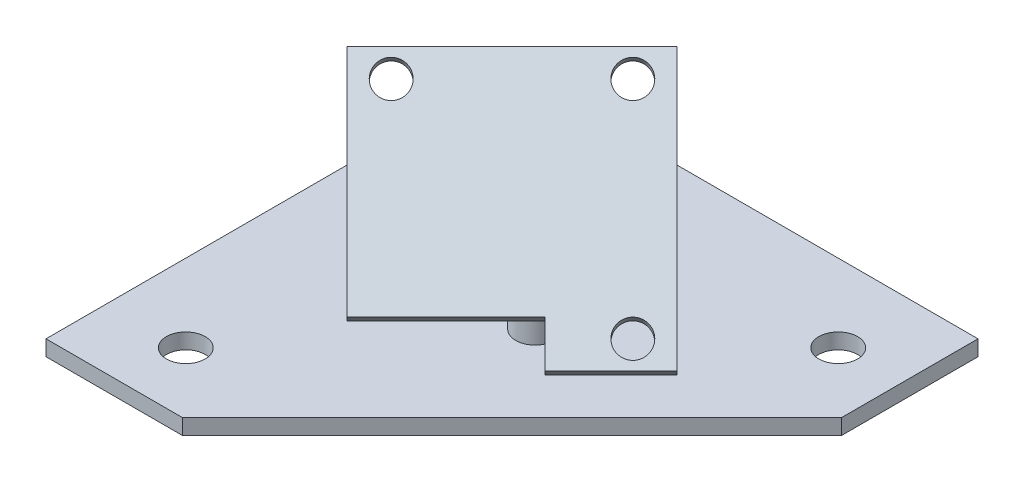
from build123d import *

# Parameters (mm, degrees)
SKETCH_1_R      = 2.5
EXTRUDE_1_DEPTH = 2
SKETCH_2_R      = 2
EXTRUDE_3_DEPTH = 2
EXTRUDE_4_REACH = 90.577
SKETCH_4_R      = 2.5


with BuildPart() as part:
    # 草图1 → 凸台-拉伸1 (new body)
    with BuildSketch(Plane(origin=(0, 0, 0), x_dir=(1, 0, 0), z_dir=(0, 1, 0))):
        Polygon((17.573593129, -60), (60, -17.573593129), (60, 0), (20, 0), (20, -20), (0, -20), (0, -60), align=None)
        with Locations(Location((10, -52, 0), (0, 0, 270))):
            Circle(SKETCH_1_R, mode=Mode.SUBTRACT)
        with Locations(Location((52, -10, 0), (0, 0, 270))):
            Circle(SKETCH_1_R, mode=Mode.SUBTRACT)
    extrude(amount=EXTRUDE_1_DEPTH)



with BuildPart() as body_2:
    # 草图2 → 凸台-拉伸3 (new body)
    with BuildSketch(Plane(origin=(20.100505063, 28.426406871, 20.100505063), x_dir=(-0.7071067811865476, 0, 0.7071067811865476), z_dir=(0.5000000000000009, 0.7071067811865465, 0.5000000000000009))):
        Polygon((-3, 33.431239936), (-15, 33.431239936), (-15, 3.431239936), (15, 3.431239936), (15, 28.431239936), (11, 28.431239936), (-3, 28.431239936), align=None)
        with Locations(Location((-11, 6.431239936, 0), (0, 0, 54.735610317))):
            Circle(SKETCH_2_R, mode=Mode.SUBTRACT)
        with Locations(Location((11, 6.431239936, 0), (0, 0, 54.735610317))):
            Circle(SKETCH_2_R, mode=Mode.SUBTRACT)
        with Locations(Location((-11, 30.431239936, 0), (0, 0, 54.735610317))):
            Circle(SKETCH_2_R, mode=Mode.SUBTRACT)
    extrude(amount=EXTRUDE_3_DEPTH)


with BuildPart() as part_1:
    add(part.part)

    add(body_2.part)  # 凸台-拉伸4 merges body 2
    # 凸台-拉伸4: up to this plane
    extrude_4_end = Plane(origin=(20.100505063, 28.426406871, 20.100505063), z_dir=(0.5000000000000009, 0.7071067811865464, 0.5000000000000009))
    # 草图4 → 凸台-拉伸4 (add, up to the surface)
    with BuildSketch(Plane(origin=(0, 2, 0), x_dir=(1, 0, 0), z_dir=(0, 1, 0)), mode=Mode.PRIVATE) as extrude_4_sk1:
        with Locations(Location((30.42692979, -27.445922357, 0), (0, 0, 315))):
            Circle(SKETCH_4_R)
    extrude_4_tool1 = split(extrude(extrude_4_sk1.sketch, amount=EXTRUDE_4_REACH, mode=Mode.PRIVATE), bisect_by=extrude_4_end, keep=Keep.BOTH, mode=Mode.PRIVATE)
    add(extrude_4_tool1.solids().sort_by_distance((30.42693, 2, 27.445922))[0])


solid = part_1.part
